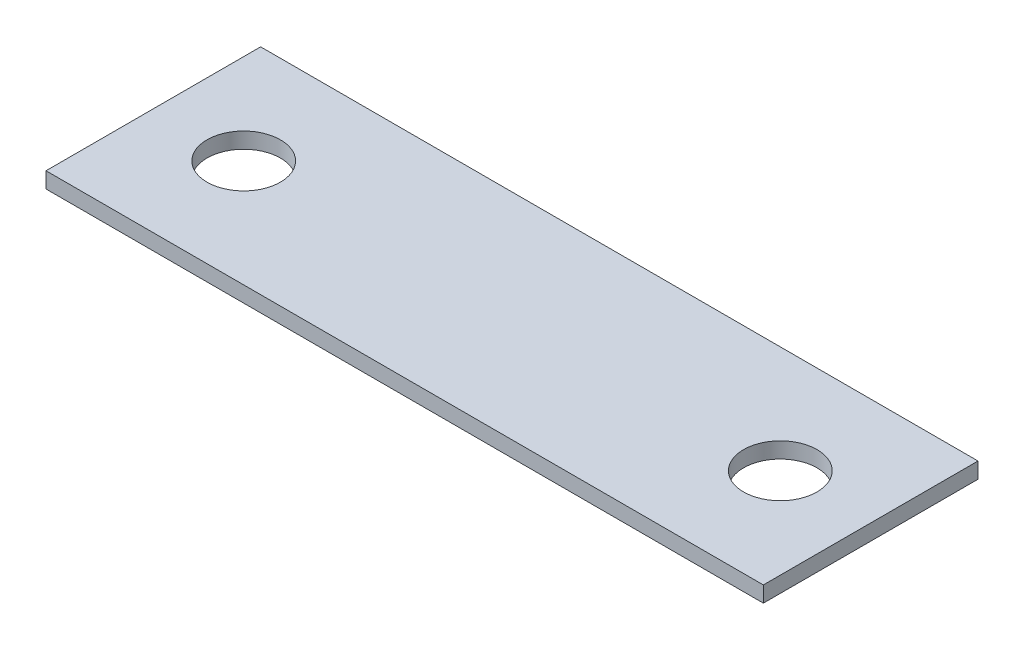
from build123d import *

# Parameters (mm, degrees)
SKETCH1_W           = 127
SKETCH1_H           = 38
SKETCH1_R           = 6.5
BOSS_EXTRUDE1_DEPTH = 2.8


with BuildPart() as part:
    # Sketch1 → Boss-Extrude1 (new body)
    with BuildSketch(Plane(origin=(0, 0, 0), x_dir=(1, 0, 0), z_dir=(0, 1, 0))):
        Rectangle(SKETCH1_W, SKETCH1_H)
        with Locations(Location((-47.5, 0, 0), (0, 0, 270))):
            Circle(SKETCH1_R, mode=Mode.SUBTRACT)
        with Locations(Location((47.5, 0, 0), (0, 0, 90))):
            Circle(SKETCH1_R, mode=Mode.SUBTRACT)
    extrude(amount=BOSS_EXTRUDE1_DEPTH)


solid = part.part
